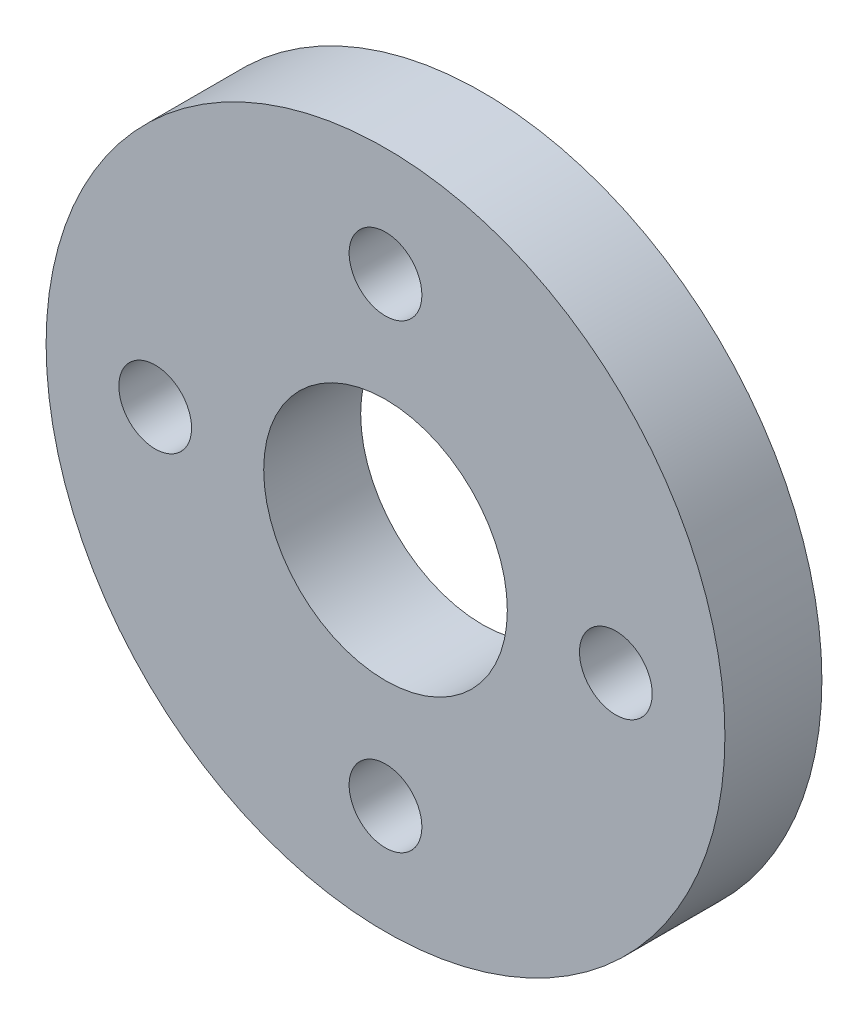
from build123d import *

# Parameters (mm, degrees)
SKETCH_1_R      = 14
SKETCH_1_R_2    = 5.025
SKETCH_1_R_3    = 1.5
EXTRUDE_1_DEPTH = 4


with BuildPart() as part:
    # 草图1 → 凸台-拉伸1 (new body)
    with BuildSketch(Plane.XY):
        Circle(SKETCH_1_R)
        Circle(SKETCH_1_R_2, mode=Mode.SUBTRACT)
        with Locations((0, -9.5)):
            Circle(SKETCH_1_R_3, mode=Mode.SUBTRACT)
        with Locations((-9.5, 0)):
            Circle(SKETCH_1_R_3, mode=Mode.SUBTRACT)
        with Locations((0, 9.5)):
            Circle(SKETCH_1_R_3, mode=Mode.SUBTRACT)
        with Locations((9.5, 0)):
            Circle(SKETCH_1_R_3, mode=Mode.SUBTRACT)
    extrude(amount=EXTRUDE_1_DEPTH)


solid = part.part
